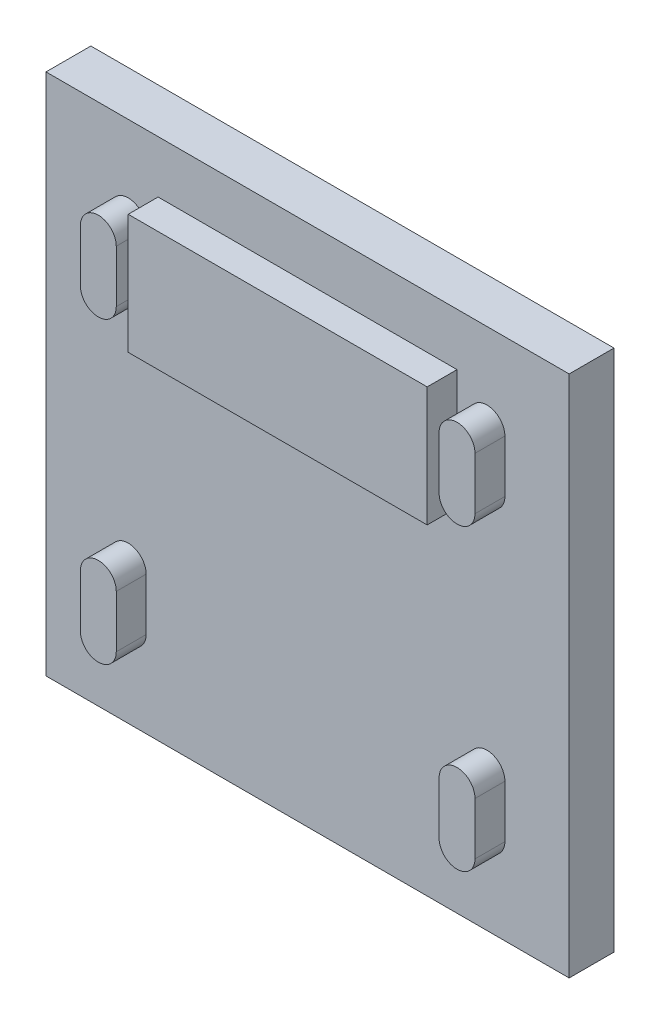
from build123d import *

# Parameters (mm, degrees)
SKETCH2_W           = 35
SKETCH2_H           = 35
BOSS_EXTRUDE1_DEPTH = 3
SKETCH3_W           = 20
SKETCH3_H           = 8
BOSS_EXTRUDE2_DEPTH = 2


with BuildPart() as part:
    # Sketch2 → Boss-Extrude1 (new body)
    with BuildSketch(Plane.XY):
        Rectangle(SKETCH2_W, SKETCH2_H)
    extrude(amount=BOSS_EXTRUDE1_DEPTH)

    # Sketch3 → Boss-Extrude2 (add)
    with BuildSketch(Plane.XY.offset(3)):
        with BuildLine():
            Line((-13.2, 8.25), (-13.2, 11.75))
            ThreePointArc((-13.2, 11.75), (-12, 12.95), (-10.8, 11.75))
            Line((-10.8, 11.75), (-10.8, 8.25))
            ThreePointArc((-10.8, 8.25), (-12, 7.05), (-13.2, 8.25))
        make_face()
        with BuildLine():
            Line((-13.2, -11.75), (-13.2, -8.25))
            ThreePointArc((-13.2, -8.25), (-12, -7.05), (-10.8, -8.25))
            Line((-10.8, -8.25), (-10.8, -11.75))
            ThreePointArc((-10.8, -11.75), (-12, -12.95), (-13.2, -11.75))
        make_face()
        with BuildLine():
            Line((10.8, -11.75), (10.8, -8.25))
            ThreePointArc((10.8, -8.25), (12, -7.05), (13.2, -8.25))
            Line((13.2, -8.25), (13.2, -11.75))
            ThreePointArc((13.2, -11.75), (12, -12.95), (10.8, -11.75))
        make_face()
        with BuildLine():
            Line((10.8, 8.25), (10.8, 11.75))
            ThreePointArc((10.8, 11.75), (12, 12.95), (13.2, 11.75))
            Line((13.2, 11.75), (13.2, 8.25))
            ThreePointArc((13.2, 8.25), (12, 7.05), (10.8, 8.25))
        make_face()
        with Locations((0, 10)):
            Rectangle(SKETCH3_W, SKETCH3_H)
    extrude(amount=BOSS_EXTRUDE2_DEPTH)


solid = part.part
